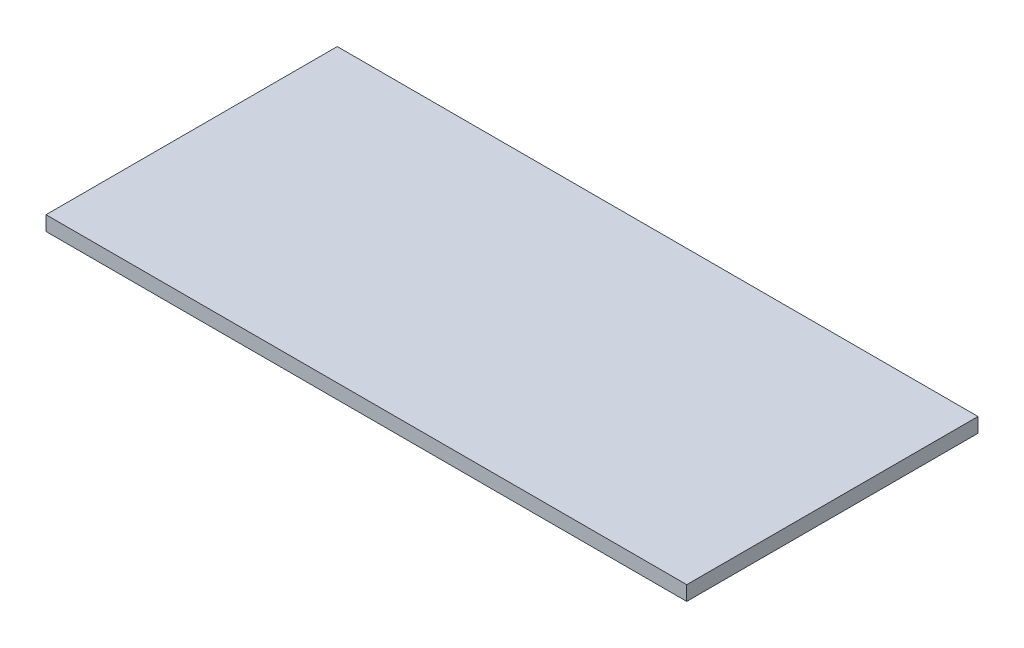
from build123d import *

# Parameters (mm, degrees)
SKETCH1_W           = 139.7
SKETCH1_H           = 63.5
BOSS_EXTRUDE1_DEPTH = 3.175


with BuildPart() as part:
    # Sketch1 → Boss-Extrude1 (new body)
    with BuildSketch(Plane(origin=(0, 0, 0), x_dir=(1, 0, 0), z_dir=(0, 1, 0))):
        with Locations((69.85, 31.75)):
            Rectangle(SKETCH1_W, SKETCH1_H)
    extrude(amount=BOSS_EXTRUDE1_DEPTH)


solid = part.part
